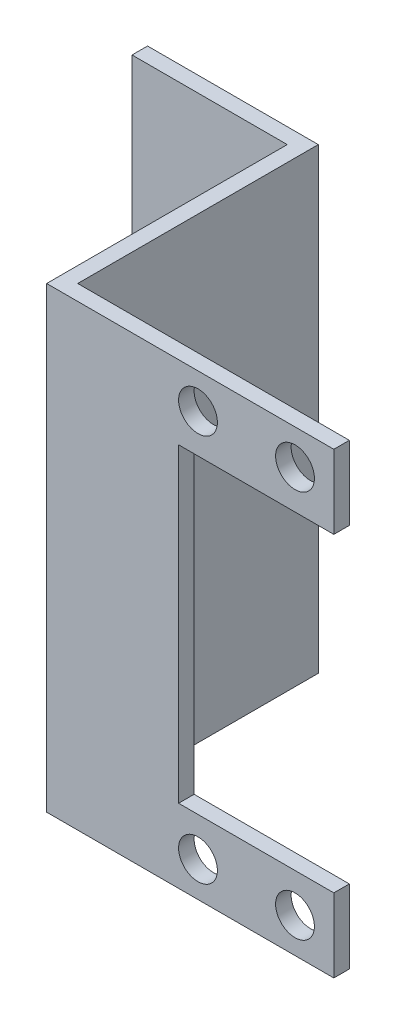
from build123d import *

# Parameters (mm, degrees)
SKETCH_1_W          = 37
SKETCH_1_H          = 59
EXTRUDE_1_DEPTH     = 2
SKETCH_2_W          = 20
SKETCH_2_H          = 40
CUT_EXTRUDE_1_DEPTH = 2
SKETCH_3_W          = 2
SKETCH_3_H          = 59
EXTRUDE_2_DEPTH     = 31
SKETCH_4_W          = 2
SKETCH_4_H          = 59
EXTRUDE_3_DEPTH     = 20
SKETCH_5_R          = 2
CUT_EXTRUDE_2_DEPTH = 20
SKETCH_6_R          = 2.5
CUT_EXTRUDE_3_DEPTH = 20


with BuildPart() as part:
    # 草图1 → 凸台-拉伸1 (new body)
    with BuildSketch(Plane.XY):
        with Locations((18.5, 29.5)):
            Rectangle(SKETCH_1_W, SKETCH_1_H)
    extrude(amount=EXTRUDE_1_DEPTH)

    # 草图2 → 切除-拉伸1 (cut)
    with BuildSketch(Plane.XY.offset(2)):
        with Locations((27, 29.5)):
            Rectangle(SKETCH_2_W, SKETCH_2_H)
    extrude(amount=-CUT_EXTRUDE_1_DEPTH, mode=Mode.SUBTRACT)

    # 草图3 → 凸台-拉伸2 (add)
    with BuildSketch(Plane(origin=(0, 0, 0), x_dir=(-1, 0, 0), z_dir=(0, 0, -1))):
        with Locations((-1, 29.5)):
            Rectangle(SKETCH_3_W, SKETCH_3_H)
    extrude(amount=EXTRUDE_2_DEPTH)

    # 草图4 → 凸台-拉伸3 (add)
    with BuildSketch(Plane.ZY):
        with Locations((-30, 29.5)):
            Rectangle(SKETCH_4_W, SKETCH_4_H)
    extrude(amount=EXTRUDE_3_DEPTH)

    # 草图5 → 切除-拉伸2 (cut)
    with BuildSketch(Plane(origin=(0, 0, -31), x_dir=(-1, 0, 0), z_dir=(0, 0, -1))):
        with Locations((10, 44.5)):
            Circle(SKETCH_5_R)
        with Locations((10, 14.5)):
            Circle(SKETCH_5_R)
    extrude(amount=-CUT_EXTRUDE_2_DEPTH, mode=Mode.SUBTRACT)

    # 草图6 → 切除-拉伸3 (cut)
    with BuildSketch(Plane(origin=(0, 0, 0), x_dir=(-1, 0, 0), z_dir=(0, 0, -1))):
        with Locations((-32, 54.5)):
            Circle(SKETCH_6_R)
        with Locations((-19.5, 54.5)):
            Circle(SKETCH_6_R)
        with Locations((-19.5, 4.5)):
            Circle(SKETCH_6_R)
        with Locations((-32, 4.5)):
            Circle(SKETCH_6_R)
    extrude(amount=-CUT_EXTRUDE_3_DEPTH, mode=Mode.SUBTRACT)


solid = part.part
